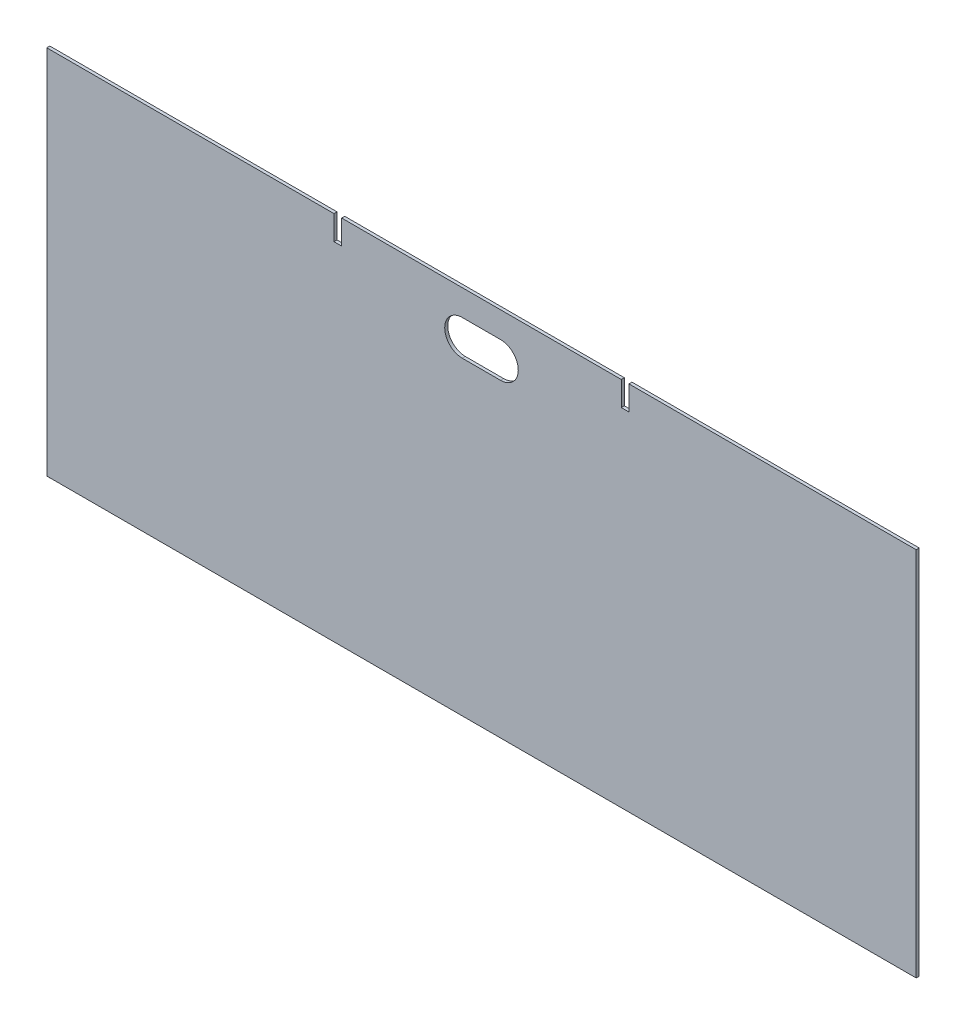
from build123d import *

# Parameters (mm, degrees)
SKETCH1_W         = 1816.1
SKETCH1_H         = 774.7
BASE_DEPTH        = 6.35
SKETCH2_W         = 15.875
SKETCH2_H         = 50.8
RIB_RELIEF_DEPTH  = 1194.631105074
CUTOUT_DEPTH      = 1194.631105074
CUTOUT_DEPTH_BACK = 1194.631105074


with BuildPart() as part:
    # Sketch1 → base (new body)
    with BuildSketch(Plane.XY):
        with Locations((0, 387.35)):
            Rectangle(SKETCH1_W, SKETCH1_H)
    extrude(amount=BASE_DEPTH)

    # Sketch2 → rib-relief (cut, through all)
    with BuildSketch(Plane.XY.offset(6.35)):
        with Locations((-300.0375, 749.3)):
            Rectangle(SKETCH2_W, SKETCH2_H)
        with Locations((300.0375, 749.3)):
            Rectangle(SKETCH2_W, SKETCH2_H)
    extrude(amount=-RIB_RELIEF_DEPTH, mode=Mode.SUBTRACT)

    # Sketch3 → cutout (cut, two sides: drawn at the far end of the back side and taken through both)
    with BuildSketch(Plane.XY.offset(6.35).offset(-CUTOUT_DEPTH_BACK)):
        with BuildLine():
            Line((-40, 720.725), (40, 720.725))
            ThreePointArc((40, 720.725), (76.825, 683.9), (40, 647.075))
            Line((40, 647.075), (-40, 647.075))
            ThreePointArc((-40, 647.075), (-76.825, 683.9), (-40, 720.725))
        make_face()
    extrude(amount=CUTOUT_DEPTH + CUTOUT_DEPTH_BACK, mode=Mode.SUBTRACT)


solid = part.part
